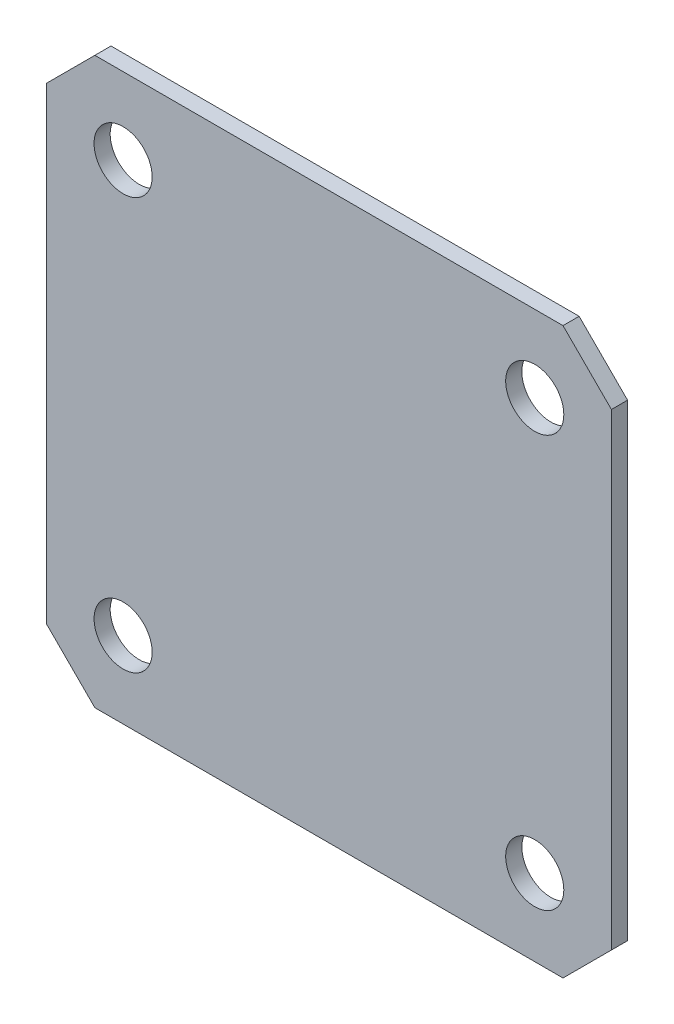
from build123d import *

# Parameters (mm, degrees)
SKETCH1_W      = 35
SKETCH1_H      = 35
SKETCH1_R      = 1.8
EXTRUDE1_DEPTH = 1
CHAMFER1_SIZE  = 3


with BuildPart() as part:
    # Sketch1 → Extrude1 (new body)
    with BuildSketch(Plane.XY):
        Rectangle(SKETCH1_W, SKETCH1_H)
        with Locations((-12.75, 12.75)):
            Circle(SKETCH1_R, mode=Mode.SUBTRACT)
        with Locations((12.75, 12.75)):
            Circle(SKETCH1_R, mode=Mode.SUBTRACT)
        with Locations((-12.75, -12.75)):
            Circle(SKETCH1_R, mode=Mode.SUBTRACT)
        with Locations((12.75, -12.75)):
            Circle(SKETCH1_R, mode=Mode.SUBTRACT)
    extrude(amount=EXTRUDE1_DEPTH)

    # Chamfer1
    chamfer1_edges = [part.edges().sort_by_distance(p)[0] for p in [
        (-17.5, 17.5, 0.5),
        (17.5, 17.5, 0.5),
        (17.5, -17.5, 0.5),
        (-17.5, -17.5, 0.5),
    ]]
    chamfer(chamfer1_edges, length=CHAMFER1_SIZE)


solid = part.part
